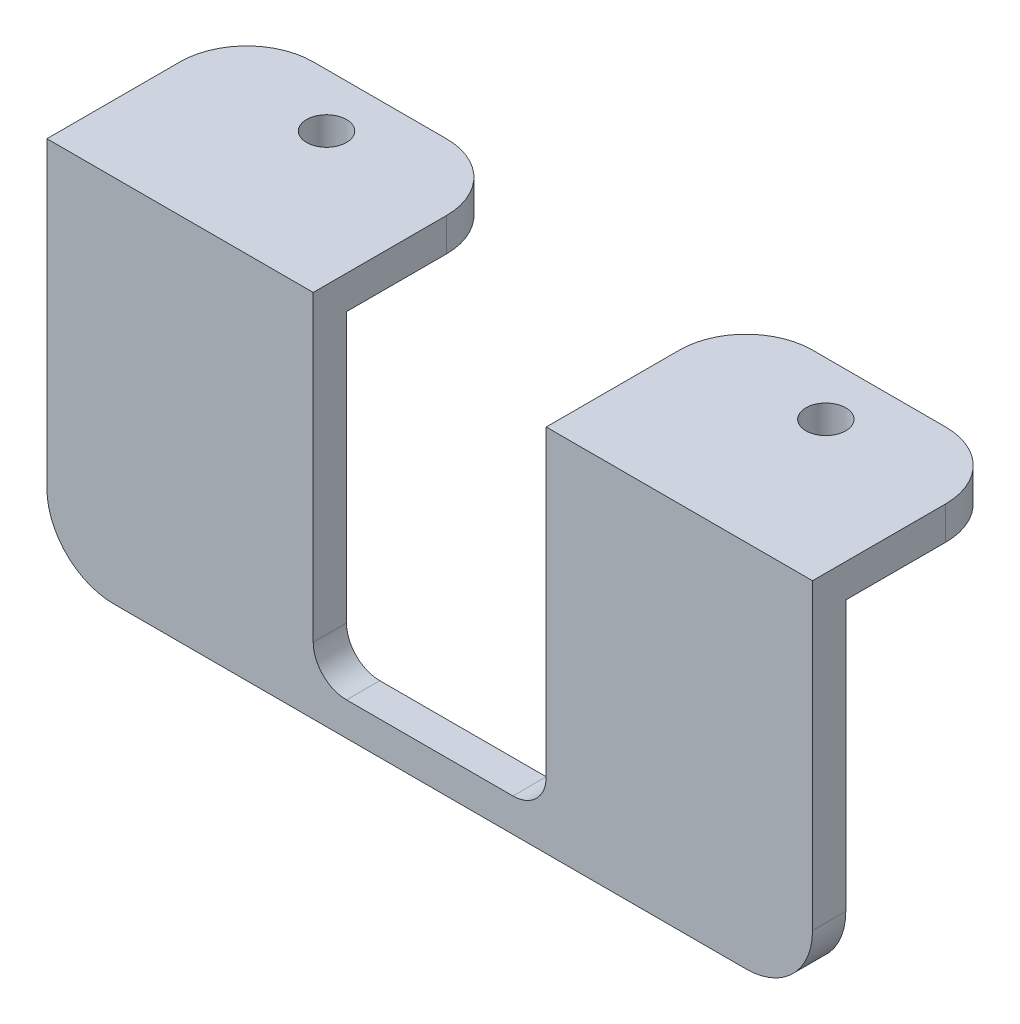
from build123d import *

# Parameters (mm, degrees)
SKETCH1_W           = 40
SKETCH1_H           = 30
BOSS_EXTRUDE1_DEPTH = 5
SKETCH2_W           = 40
SKETCH2_H           = 5
BOSS_EXTRUDE2_DEPTH = 45.5
SKETCH3_W           = 57.5
SKETCH3_H           = 5
BOSS_EXTRUDE3_DEPTH = 5
FILLET1_R           = 10
FILLET2_R           = 5
FILLET3_R           = 10
SKETCH4_R           = 3
CUT_EXTRUDE1_DEPTH  = 86.36099812


with BuildPart() as part:
    # Sketch1 → Boss-Extrude1 (new body)
    with BuildSketch(Plane(origin=(0, 0, 0), x_dir=(1, 0, 0), z_dir=(0, 1, 0))):
        with Locations((37.5, 15)):
            Rectangle(SKETCH1_W, SKETCH1_H)
    extrude(amount=BOSS_EXTRUDE1_DEPTH)

    # Sketch2 → Boss-Extrude2 (add)
    with BuildSketch(Plane.XZ):
        with Locations((37.5, -2.5)):
            Rectangle(SKETCH2_W, SKETCH2_H)
    extrude(amount=BOSS_EXTRUDE2_DEPTH)

    # Sketch3 → Boss-Extrude3 (add)
    with BuildSketch(Plane.XZ.offset(45.5)):
        with Locations((28.75, -2.5)):
            Rectangle(SKETCH3_W, SKETCH3_H)
    extrude(amount=BOSS_EXTRUDE3_DEPTH)

    # Fillet1
    fillet1_edges = [part.edges().sort_by_distance(p)[0] for p in [
        (57.5, -50.5, -2.5),
    ]]
    fillet(fillet1_edges, radius=FILLET1_R)

    # Fillet2
    fillet2_edges = [part.edges().sort_by_distance(p)[0] for p in [
        (17.5, -45.5, -2.5),
    ]]
    fillet(fillet2_edges, radius=FILLET2_R)

    # Fillet3
    fillet3_edges = [part.edges().sort_by_distance(p)[0] for p in [
        (17.5, 2.5, -30),
        (57.5, 2.5, -30),
    ]]
    fillet(fillet3_edges, radius=FILLET3_R)

    # Sketch4 → Cut-Extrude1 (cut, through all)
    with BuildSketch(Plane(origin=(0, 5, 0), x_dir=(1, 0, 0), z_dir=(0, 1, 0))):
        with Locations(Location((37.5, 22, 0), (0, 0, 270))):
            Circle(SKETCH4_R)
    extrude(amount=-CUT_EXTRUDE1_DEPTH, mode=Mode.SUBTRACT)

    # Mirror1: part across plane


with BuildPart() as part_1:
    add(part.part)
    add(part.part.mirror(Plane(origin=(0, 0, 0), x_dir=(0, 0, 1), z_dir=(1, 0, 0))))


solid = part_1.part
